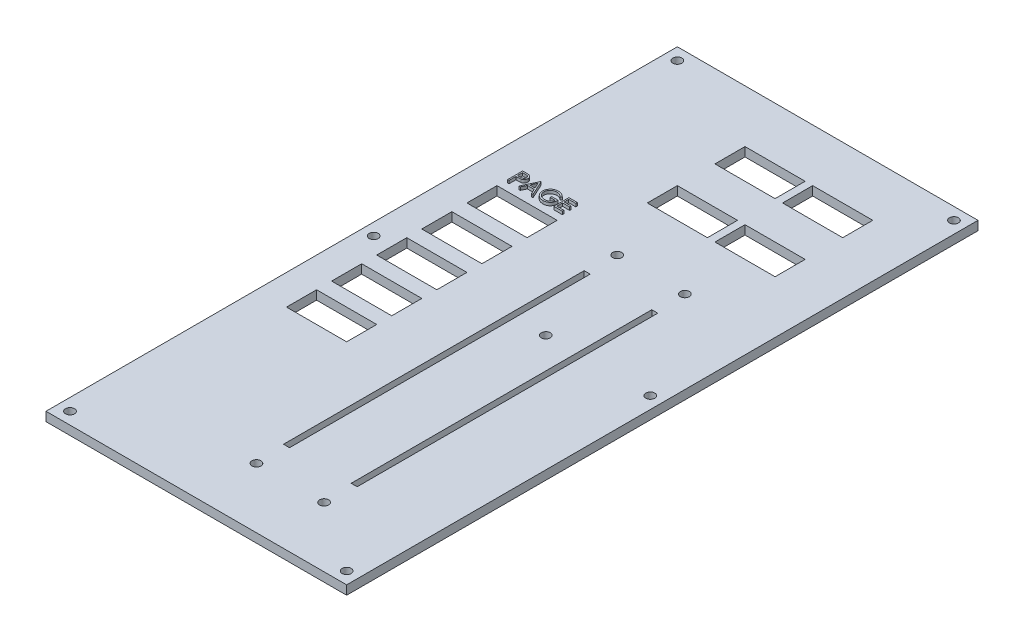
from build123d import *

# Parameters (mm, degrees)
SKETCH1_W            = 100
SKETCH1_H            = 210
BOSS_EXTRUDE1_DEPTH  = 3
CUT_EXTRUDE1_REACH   = 118.336
SKETCH3_R            = 1.5
SKETCH3_W            = 2
SKETCH3_H            = 100
LPATTERN1_COUNT      = 2
LPATTERN1_PITCH      = 22.5
CUT_EXTRUDE2_REACH   = 118.336
SKETCH4_W            = 20
SKETCH4_H            = 10
LPATTERN2_COUNT      = 2
LPATTERN2_PITCH      = 22.5
LPATTERN2_COUNT_DIR2 = 2
LPATTERN2_PITCH_DIR2 = 22.5
CUT_EXTRUDE3_REACH   = 118.336
SKETCH5_R            = 1.5
CUT_EXTRUDE4_REACH   = 118.336
SKETCH6_W            = 20
SKETCH6_H            = 10
LPATTERN3_COUNT      = 5
LPATTERN3_PITCH      = 15
CUT_EXTRUDE5_REACH   = 118.336
SKETCH7_R            = 1.5
CUT_EXTRUDE6_REACH   = 118.336
SKETCH8_R            = 1.5
BOSS_EXTRUDE2_DEPTH  = 1


with BuildPart() as part:
    # Sketch1 → Boss-Extrude1 (new body)
    with BuildSketch(Plane(origin=(0, 0, 0), x_dir=(1, 0, 0), z_dir=(0, 1, 0))):
        Rectangle(SKETCH1_W, SKETCH1_H)
    extrude(amount=BOSS_EXTRUDE1_DEPTH)

    # Sketch3 → Cut-Extrude1 (cut, up to next)
    with BuildSketch(Plane(origin=(0, 3, 0), x_dir=(1, 0, 0), z_dir=(0, 1, 0)), mode=Mode.PRIVATE) as cut_extrude1_sk1:
        with Locations(Location((0, -85, 0), (0, 0, 270))):
            Circle(SKETCH3_R)
    cut_extrude1_tool1 = extrude(cut_extrude1_sk1.sketch, amount=-CUT_EXTRUDE1_REACH, mode=Mode.PRIVATE) & part.part
    # Sketch3 → Cut-Extrude1 (cut, up to next)
    with BuildSketch(Plane(origin=(0, 3, 0), x_dir=(1, 0, 0), z_dir=(0, 1, 0)), mode=Mode.PRIVATE) as cut_extrude1_sk2:
        with Locations(Location((0, 35, 0), (0, 0, 270))):
            Circle(SKETCH3_R)
    cut_extrude1_tool2 = extrude(cut_extrude1_sk2.sketch, amount=-CUT_EXTRUDE1_REACH, mode=Mode.PRIVATE) & part.part
    # Sketch3 → Cut-Extrude1 (cut, up to next)
    with BuildSketch(Plane(origin=(0, 3, 0), x_dir=(1, 0, 0), z_dir=(0, 1, 0)), mode=Mode.PRIVATE) as cut_extrude1_sk3:
        with Locations((0, -25)):
            Rectangle(SKETCH3_W, SKETCH3_H)
    cut_extrude1_tool3 = extrude(cut_extrude1_sk3.sketch, amount=-CUT_EXTRUDE1_REACH, mode=Mode.PRIVATE) & part.part
    cut_extrude1_1 = cut_extrude1_tool1.solids().sort_by_distance((0, 3, 85))[0]
    add(cut_extrude1_1, mode=Mode.SUBTRACT)
    cut_extrude1_2 = cut_extrude1_tool2.solids().sort_by_distance((0, 3, -35))[0]
    add(cut_extrude1_2, mode=Mode.SUBTRACT)
    cut_extrude1_3 = cut_extrude1_tool3.solids().sort_by_distance((0, 3, 25))[0]
    add(cut_extrude1_3, mode=Mode.SUBTRACT)
    cut_extrude1 = cut_extrude1_1 + cut_extrude1_2 + cut_extrude1_3  # Cut-Extrude1 as one shape, for the pattern or mirror that repeats it

    # LPattern1: Cut-Extrude1 ×2
    with Locations(*[(i * LPATTERN1_PITCH, 0, 0) for i in range(1, LPATTERN1_COUNT)]):
        add(cut_extrude1, mode=Mode.SUBTRACT)

    # Sketch4 → Cut-Extrude2 (cut, up to next)
    with BuildSketch(Plane(origin=(0, 3, 0), x_dir=(1, 0, 0), z_dir=(0, 1, 0)), mode=Mode.PRIVATE) as cut_extrude2_sk1:
        with Locations((0, 60)):
            Rectangle(SKETCH4_W, SKETCH4_H)
    cut_extrude2_tool1 = extrude(cut_extrude2_sk1.sketch, amount=-CUT_EXTRUDE2_REACH, mode=Mode.PRIVATE) & part.part
    cut_extrude2 = cut_extrude2_tool1.solids().sort_by_distance((0, 3, -60))[0]
    add(cut_extrude2, mode=Mode.SUBTRACT)

    # LPattern2: Cut-Extrude2 2 × 2
    with Locations(*[(i * LPATTERN2_PITCH, 0, -j * LPATTERN2_PITCH_DIR2) for i in range(LPATTERN2_COUNT) for j in range(LPATTERN2_COUNT_DIR2) if (i, j) != (0, 0)]):
        add(cut_extrude2, mode=Mode.SUBTRACT)

    # Sketch5 → Cut-Extrude3 (cut, up to next)
    with BuildSketch(Plane(origin=(0, 3, 0), x_dir=(1, 0, 0), z_dir=(0, 1, 0)), mode=Mode.PRIVATE) as cut_extrude3_sk1:
        with Locations(Location((-46, 101, 0), (0, 0, 270))):
            Circle(SKETCH5_R)
    cut_extrude3_tool1 = extrude(cut_extrude3_sk1.sketch, amount=-CUT_EXTRUDE3_REACH, mode=Mode.PRIVATE) & part.part
    # Sketch5 → Cut-Extrude3 (cut, up to next)
    with BuildSketch(Plane(origin=(0, 3, 0), x_dir=(1, 0, 0), z_dir=(0, 1, 0)), mode=Mode.PRIVATE) as cut_extrude3_sk2:
        with Locations(Location((46, 101, 0), (0, 0, 270))):
            Circle(SKETCH5_R)
    cut_extrude3_tool2 = extrude(cut_extrude3_sk2.sketch, amount=-CUT_EXTRUDE3_REACH, mode=Mode.PRIVATE) & part.part
    # Sketch5 → Cut-Extrude3 (cut, up to next)
    with BuildSketch(Plane(origin=(0, 3, 0), x_dir=(1, 0, 0), z_dir=(0, 1, 0)), mode=Mode.PRIVATE) as cut_extrude3_sk3:
        with Locations(Location((46, -101, 0), (0, 0, 270))):
            Circle(SKETCH5_R)
    cut_extrude3_tool3 = extrude(cut_extrude3_sk3.sketch, amount=-CUT_EXTRUDE3_REACH, mode=Mode.PRIVATE) & part.part
    # Sketch5 → Cut-Extrude3 (cut, up to next)
    with BuildSketch(Plane(origin=(0, 3, 0), x_dir=(1, 0, 0), z_dir=(0, 1, 0)), mode=Mode.PRIVATE) as cut_extrude3_sk4:
        with Locations(Location((-46, -101, 0), (0, 0, 270))):
            Circle(SKETCH5_R)
    cut_extrude3_tool4 = extrude(cut_extrude3_sk4.sketch, amount=-CUT_EXTRUDE3_REACH, mode=Mode.PRIVATE) & part.part
    # Sketch5 → Cut-Extrude3 (cut, up to next)
    with BuildSketch(Plane(origin=(0, 3, 0), x_dir=(1, 0, 0), z_dir=(0, 1, 0)), mode=Mode.PRIVATE) as cut_extrude3_sk5:
        with Locations(Location((11.25, 0, 0), (0, 0, 270))):
            Circle(SKETCH5_R)
    cut_extrude3_tool5 = extrude(cut_extrude3_sk5.sketch, amount=-CUT_EXTRUDE3_REACH, mode=Mode.PRIVATE) & part.part
    add(cut_extrude3_tool1.solids().sort_by_distance((-46, 3, -101))[0], mode=Mode.SUBTRACT)
    add(cut_extrude3_tool2.solids().sort_by_distance((46, 3, -101))[0], mode=Mode.SUBTRACT)
    add(cut_extrude3_tool3.solids().sort_by_distance((46, 3, 101))[0], mode=Mode.SUBTRACT)
    add(cut_extrude3_tool4.solids().sort_by_distance((-46, 3, 101))[0], mode=Mode.SUBTRACT)
    add(cut_extrude3_tool5.solids().sort_by_distance((11.25, 3, 0))[0], mode=Mode.SUBTRACT)

    # Sketch6 → Cut-Extrude4 (cut, up to next)
    with BuildSketch(Plane(origin=(0, 3, 0), x_dir=(1, 0, 0), z_dir=(0, 1, 0)), mode=Mode.PRIVATE) as cut_extrude4_sk1:
        with Locations((-30, 30)):
            Rectangle(SKETCH6_W, SKETCH6_H)
    cut_extrude4_tool1 = extrude(cut_extrude4_sk1.sketch, amount=-CUT_EXTRUDE4_REACH, mode=Mode.PRIVATE) & part.part
    cut_extrude4 = cut_extrude4_tool1.solids().sort_by_distance((-30, 3, -30))[0]
    add(cut_extrude4, mode=Mode.SUBTRACT)

    # LPattern3: Cut-Extrude4 ×5
    with Locations(*[(0, 0, i * LPATTERN3_PITCH) for i in range(1, LPATTERN3_COUNT)]):
        add(cut_extrude4, mode=Mode.SUBTRACT)

    # Sketch7 → Cut-Extrude5 (cut, up to next)
    with BuildSketch(Plane(origin=(0, 3, 0), x_dir=(1, 0, 0), z_dir=(0, 1, 0)), mode=Mode.PRIVATE) as cut_extrude5_sk1:
        with Locations(Location((-46, 0, 0), (0, 0, 270))):
            Circle(SKETCH7_R)
    cut_extrude5_tool1 = extrude(cut_extrude5_sk1.sketch, amount=-CUT_EXTRUDE5_REACH, mode=Mode.PRIVATE) & part.part
    add(cut_extrude5_tool1.solids().sort_by_distance((-46, 3, 0))[0], mode=Mode.SUBTRACT)

    # Sketch8 → Cut-Extrude6 (cut, up to next)
    with BuildSketch(Plane(origin=(0, 3, 0), x_dir=(1, 0, 0), z_dir=(0, 1, 0)), mode=Mode.PRIVATE) as cut_extrude6_sk1:
        with Locations(Location((46, 0, 0), (0, 0, 270))):
            Circle(SKETCH8_R)
    cut_extrude6_tool1 = extrude(cut_extrude6_sk1.sketch, amount=-CUT_EXTRUDE6_REACH, mode=Mode.PRIVATE) & part.part
    add(cut_extrude6_tool1.solids().sort_by_distance((46, 3, 0))[0], mode=Mode.SUBTRACT)

    # Sketch10 → Boss-Extrude2 (add)
    # profile 1 of 4: a face of its own
    with BuildSketch(Plane(origin=(0, 3, 0), x_dir=(1, 0, 0), z_dir=(0, 1, 0))):
        with BuildLine():
            Line((-38.958974359, 42.5), (-37.978405449, 42.5))
            add(Edge.make_bspline(
                [(-37.978405449, 42.5), (-37.910961297, 42.499925863), (-37.781735307, 42.499783812), (-37.596428085, 42.495477032), (-37.428128468, 42.489724615), (-37.277199353, 42.481750482), (-37.143176355, 42.472326781), (-37.026665927, 42.459109582), (-36.926752276, 42.44530916), (-36.866885919, 42.431278579), (-36.839583333, 42.424879808)],
                knots=[0, 0, 0, 0, 1.415646017, 2.712440637, 3.8905458, 4.950247383, 5.884950622, 6.709939814, 7.411656543, 8, 8, 8, 8], degree=3))
            add(Edge.make_bspline(
                [(-36.839583333, 42.424879808), (-36.805021142, 42.415419879), (-36.736711175, 42.396722934), (-36.638281113, 42.359274758), (-36.544632763, 42.314871665), (-36.455444822, 42.264266036), (-36.371813275, 42.205286659), (-36.292490359, 42.140324348), (-36.218176101, 42.06787925), (-36.149288399, 41.988763907), (-36.086024402, 41.904306464), (-36.031553427, 41.813246136), (-35.985943102, 41.717115703), (-35.946824143, 41.615982029), (-35.918669208, 41.508995853), (-35.897459352, 41.39690055), (-35.883997026, 41.279708135), (-35.882707652, 41.19962261), (-35.882051282, 41.158854167)],
                knots=[0, 0, 0, 0, 0.999701418, 1.975846123, 2.934577507, 3.890451536, 4.834027766, 5.787354733, 6.749476667, 7.726910423, 8.712836071, 9.690891519, 10.682875813, 11.679750201, 12.712814741, 13.765529915, 14.8625177, 16, 16, 16, 16], degree=3))
            add(Edge.make_bspline(
                [(-35.882051282, 41.158854167), (-35.882653317, 41.117743057), (-35.88383124, 41.037306394), (-35.897968791, 40.919630982), (-35.917011922, 40.807176139), (-35.946293425, 40.70019121), (-35.984644386, 40.599311538), (-36.029633033, 40.502995492), (-36.08389522, 40.412881675), (-36.146244976, 40.328642936), (-36.215604397, 40.250200204), (-36.291680023, 40.178121926), (-36.374164726, 40.112830014), (-36.462796366, 40.054178095), (-36.558439008, 40.003526267), (-36.659642084, 39.958158688), (-36.767285251, 39.920057173), (-36.841774556, 39.900014228), (-36.879647436, 39.889823718)],
                knots=[0, 0, 0, 0, 1.121902311, 2.195077645, 3.232258892, 4.234102512, 5.217864754, 6.176164875, 7.132989551, 8.084763148, 9.034132444, 9.988522005, 10.94243251, 11.903244335, 12.886203696, 13.894208494, 14.929344452, 16, 16, 16, 16], degree=3))
            add(Edge.make_bspline(
                [(-36.879647436, 39.889823718), (-36.910972199, 39.883162316), (-36.979622238, 39.868563468), (-37.09268327, 39.852265672), (-37.224319535, 39.838354814), (-37.374351364, 39.827924617), (-37.542644085, 39.81899552), (-37.729288738, 39.811898243), (-37.934651706, 39.807998451), (-38.07789634, 39.807797319), (-38.152684295, 39.807692308)],
                knots=[0, 0, 0, 0, 0.601384939, 1.31797006, 2.144135048, 3.087295005, 4.142315834, 5.309527816, 6.595305764, 8, 8, 8, 8], degree=3))
            Line((-38.152684295, 39.807692308), (-38.51025641, 39.807692308))
            Line((-38.51025641, 39.807692308), (-38.51025641, 37.5))
            Line((-38.51025641, 37.5), (-38.958974359, 37.5))
            Line((-38.958974359, 37.5), (-38.958974359, 42.5))
        make_face()
        with BuildLine():
            Line((-38.51025641, 41.987179487), (-38.51025641, 40.320512821))
            Line((-38.51025641, 40.320512821), (-37.634855769, 40.309495192))
            add(Edge.make_bspline(
                [(-37.634855769, 40.309495192), (-37.592113018, 40.309473101), (-37.509599018, 40.309430456), (-37.390404414, 40.315123632), (-37.279819717, 40.321695821), (-37.17818461, 40.331318569), (-37.085453275, 40.344920366), (-37.001471091, 40.35865142), (-36.926889258, 40.378516224), (-36.839604684, 40.405263465), (-36.742342759, 40.450881488), (-36.636531975, 40.517095616), (-36.546859709, 40.601496628), (-36.469262142, 40.69639353), (-36.407682317, 40.801963715), (-36.362602328, 40.914919339), (-36.33611496, 41.034101981), (-36.332563255, 41.115656465), (-36.330769231, 41.156850962)],
                knots=[0, 0, 0, 0, 1.160613943, 2.240541288, 3.23993089, 4.169200891, 5.011653406, 5.7853311, 6.478053781, 7.106038997, 8.262395093, 9.384106736, 10.481365981, 11.59014053, 12.70357646, 13.786202915, 14.881775077, 16, 16, 16, 16], degree=3))
            add(Edge.make_bspline(
                [(-36.330769231, 41.156850962), (-36.332573011, 41.197048838), (-36.336158704, 41.276957241), (-36.362809937, 41.394069756), (-36.407594671, 41.505835048), (-36.469675521, 41.610082313), (-36.545019992, 41.704637747), (-36.632590482, 41.7867765), (-36.732180856, 41.852807504), (-36.824821186, 41.895426478), (-36.907108594, 41.9214483), (-36.978582823, 41.939655215), (-37.059283786, 41.954191795), (-37.149237757, 41.965962513), (-37.24774752, 41.976038887), (-37.355659398, 41.982875997), (-37.472564603, 41.986878077), (-37.553722561, 41.987076585), (-37.595793269, 41.987179487)],
                knots=[0, 0, 0, 0, 1.120700087, 2.227813068, 3.331159281, 4.466773991, 5.599788987, 6.693661531, 7.80175334, 8.91857717, 9.525282508, 10.207424825, 10.974604443, 11.810962634, 12.737642355, 13.736264703, 14.826523623, 16, 16, 16, 16], degree=3))
            Line((-37.595793269, 41.987179487), (-38.51025641, 41.987179487))
        make_face(mode=Mode.SUBTRACT)
    # profile 2 of 4: a face of its own
    with BuildSketch(Plane(origin=(0, 3, 0), x_dir=(1, 0, 0), z_dir=(0, 1, 0))):
        Polygon((-32.805128205, 42.5), (-30.497435897, 37.5), (-30.985216346, 37.5), (-31.724399038, 39.102564103), (-33.991025641, 39.102564103), (-34.751241987, 37.5), (-35.241025641, 37.5), (-32.869230769, 42.5), align=None)
        Polygon((-32.8421875, 41.525440705), (-33.747636218, 39.615384615), (-31.960777244, 39.615384615), align=None, mode=Mode.SUBTRACT)
    # profile 3 of 4: a face of its own
    with BuildSketch(Plane(origin=(0, 3, 0), x_dir=(1, 0, 0), z_dir=(0, 1, 0))):
        with BuildLine():
            Line((-24.920512821, 41.646634615), (-25.305128205, 41.282051282))
            add(Edge.make_bspline(
                [(-25.305128205, 41.282051282), (-25.374726617, 41.347523943), (-25.512263826, 41.476908033), (-25.736492744, 41.644780884), (-25.970440793, 41.788589598), (-26.212887217, 41.905598507), (-26.457828008, 41.998959594), (-26.702011974, 42.065428365), (-26.942934405, 42.107817705), (-27.103173288, 42.112886804), (-27.18213141, 42.115384615)],
                knots=[0, 0, 0, 0, 1.08915593, 2.152340314, 3.188132944, 4.216796309, 5.218260357, 6.173443236, 7.099959455, 8, 8, 8, 8], degree=3))
            add(Edge.make_bspline(
                [(-27.18213141, 42.115384615), (-27.230580982, 42.11479375), (-27.327354468, 42.113613551), (-27.471100103, 42.098550386), (-27.613338155, 42.076886295), (-27.753800119, 42.045540755), (-27.8927591, 42.005813528), (-28.029731803, 41.956120009), (-28.164973738, 41.898183945), (-28.297210997, 41.831237554), (-28.425411716, 41.757694917), (-28.54649291, 41.676197001), (-28.661226337, 41.589355873), (-28.767455516, 41.494997331), (-28.865791497, 41.393976095), (-28.958574886, 41.288171372), (-29.042542451, 41.174692488), (-29.118386972, 41.055627308), (-29.186046427, 40.933067038), (-29.245773075, 40.808191338), (-29.295911773, 40.681414403), (-29.335582423, 40.55257715), (-29.368311929, 40.422676307), (-29.391337082, 40.29081242), (-29.404318113, 40.156844298), (-29.406563513, 40.067133929), (-29.407692308, 40.022035256)],
                knots=[0, 0, 0, 0, 1.02818874, 2.053710826, 3.065248034, 4.081641283, 5.106893873, 6.131558223, 7.173050175, 8.228653731, 9.27666206, 10.308777013, 11.325269123, 12.329503258, 13.32196095, 14.316845687, 15.314881793, 16.315733098, 17.311955233, 18.285320748, 19.252783886, 20.203351036, 21.145449891, 22.095197417, 23.042428769, 24, 24, 24, 24], degree=3))
            add(Edge.make_bspline(
                [(-29.407692308, 40.022035256), (-29.40661271, 39.975934089), (-29.404456463, 39.883857641), (-29.390656007, 39.746437537), (-29.365044235, 39.611058391), (-29.33080465, 39.477275344), (-29.287974914, 39.344859275), (-29.234585391, 39.214384261), (-29.171348819, 39.085855131), (-29.098153744, 38.960429964), (-29.017887739, 38.838254216), (-28.927969052, 38.723169185), (-28.832453933, 38.61364236), (-28.727862648, 38.512105555), (-28.617549016, 38.415842846), (-28.498217193, 38.327506386), (-28.372213678, 38.245394639), (-28.239346232, 38.170542468), (-28.101056543, 38.103673131), (-27.959261182, 38.044210423), (-27.813507159, 37.995239941), (-27.66456046, 37.955328364), (-27.512598643, 37.922613653), (-27.356850354, 37.901567253), (-27.19846077, 37.886294637), (-27.091691296, 37.885177966), (-27.037900641, 37.884615385)],
                knots=[0, 0, 0, 0, 0.93586088, 1.869166235, 2.799637598, 3.729985548, 4.670839027, 5.622275134, 6.589130586, 7.576015415, 8.568469353, 9.55398029, 10.53834874, 11.515998671, 12.510579167, 13.508179873, 14.527009472, 15.561807829, 16.601455013, 17.643573243, 18.680854198, 19.719860599, 20.772568776, 21.833555941, 22.908541556, 24, 24, 24, 24], degree=3))
            add(Edge.make_bspline(
                [(-27.037900641, 37.884615385), (-26.973074431, 37.885970494), (-26.845777635, 37.88863147), (-26.658654145, 37.909346169), (-26.478935473, 37.941698732), (-26.307126611, 37.989078584), (-26.14302801, 38.049512406), (-25.986038094, 38.122362958), (-25.837392867, 38.210424471), (-25.696645476, 38.309815709), (-25.566992354, 38.420551184), (-25.450057891, 38.540043263), (-25.347707192, 38.66771193), (-25.258414765, 38.802805237), (-25.184545258, 38.946441387), (-25.123912694, 39.097916477), (-25.077436563, 39.257298637), (-25.058358028, 39.367429539), (-25.048717949, 39.423076923)],
                knots=[0, 0, 0, 0, 1.13008108, 2.219097802, 3.278683437, 4.311054135, 5.322181354, 6.324827112, 7.324222904, 8.330512327, 9.32562643, 10.293043162, 11.24128371, 12.174520618, 13.111833804, 14.052305215, 15.015860969, 16, 16, 16, 16], degree=3))
            Line((-25.048717949, 39.423076923), (-26.715384615, 39.423076923))
            Line((-26.715384615, 39.423076923), (-26.715384615, 39.935897436))
            Line((-26.715384615, 39.935897436), (-24.6, 39.935897436))
            add(Edge.make_bspline(
                [(-24.6, 39.935897436), (-24.602436926, 39.840315309), (-24.607206431, 39.653243821), (-24.640662025, 39.380429148), (-24.694685614, 39.122755301), (-24.768486059, 38.879950912), (-24.864022174, 38.652360066), (-24.980268643, 38.439751685), (-25.119085959, 38.243499284), (-25.275529447, 38.062000708), (-25.451100815, 37.900101833), (-25.641055987, 37.757807636), (-25.845708799, 37.637946757), (-26.064865666, 37.540431525), (-26.297809143, 37.464325818), (-26.545078257, 37.410366423), (-26.806337686, 37.378037904), (-26.985390082, 37.373907362), (-27.076963141, 37.371794872)],
                knots=[0, 0, 0, 0, 1.140356446, 2.231883559, 3.274166699, 4.278491846, 5.25512956, 6.21435461, 7.1637429, 8.11826594, 9.068280886, 10.0076534, 10.945064095, 11.891975133, 12.864533718, 13.863980011, 14.907571808, 16, 16, 16, 16], degree=3))
            add(Edge.make_bspline(
                [(-27.076963141, 37.371794872), (-27.133406192, 37.372607902), (-27.244730078, 37.37421146), (-27.40914569, 37.385607671), (-27.569028005, 37.403151351), (-27.724353732, 37.429644385), (-27.875694221, 37.46209389), (-28.022293628, 37.503646346), (-28.164710402, 37.551744488), (-28.303164668, 37.606452593), (-28.436399734, 37.669840674), (-28.565009044, 37.740283016), (-28.68970351, 37.817416388), (-28.809633745, 37.902574739), (-28.925424633, 37.995121111), (-29.036329553, 38.095240995), (-29.142969378, 38.202628309), (-29.209770041, 38.278884037), (-29.243429487, 38.317307692)],
                knots=[0, 0, 0, 0, 1.107784379, 2.184907829, 3.233506516, 4.263428166, 5.276301166, 6.270063455, 7.25232949, 8.225834625, 9.190232166, 10.146266622, 11.1027726, 12.066435141, 13.031522626, 14.010570082, 14.99756817, 16, 16, 16, 16], degree=3))
            add(Edge.make_bspline(
                [(-29.243429487, 38.317307692), (-29.292266533, 38.378265768), (-29.389129979, 38.499170078), (-29.51381306, 38.692884285), (-29.620100779, 38.893458371), (-29.706340525, 39.101450697), (-29.773680648, 39.316666715), (-29.821975295, 39.538831417), (-29.850271422, 39.768230889), (-29.854347904, 39.923466981), (-29.856410256, 40.002003205)],
                knots=[0, 0, 0, 0, 1.023165419, 2.029347347, 3.013907458, 3.994755782, 4.975994455, 5.96558838, 6.970761222, 8, 8, 8, 8], degree=3))
            add(Edge.make_bspline(
                [(-29.856410256, 40.002003205), (-29.855649916, 40.060812138), (-29.854138899, 40.177682577), (-29.835816733, 40.351193016), (-29.809528993, 40.521622576), (-29.770890344, 40.688831942), (-29.722181394, 40.852932788), (-29.6613907, 41.014001308), (-29.590612277, 41.172132553), (-29.508347283, 41.326238078), (-29.416798055, 41.474272954), (-29.317440597, 41.615641244), (-29.208864026, 41.74776848), (-29.092841455, 41.872327978), (-28.967988612, 41.987754902), (-28.835475149, 42.095117917), (-28.695198945, 42.19456104), (-28.546718688, 42.284517946), (-28.392250567, 42.365323118), (-28.232164851, 42.43616485), (-28.066510407, 42.494712443), (-27.896528296, 42.544389271), (-27.720931866, 42.581125186), (-27.540995385, 42.607766251), (-27.355780939, 42.625995679), (-27.230586612, 42.627461759), (-27.167107372, 42.628205128)],
                knots=[0, 0, 0, 0, 1.008945113, 2.00506715, 2.99143336, 3.967273523, 4.948097931, 5.927297278, 6.919902385, 7.919676788, 8.923139349, 9.905703106, 10.883022732, 11.856032218, 12.825136022, 13.798837087, 14.781400844, 15.773989409, 16.776158564, 17.77167057, 18.775803737, 19.789618931, 20.80898985, 21.851988756, 22.910860228, 24, 24, 24, 24], degree=3))
            add(Edge.make_bspline(
                [(-27.167107372, 42.628205128), (-27.115338452, 42.627377283), (-27.012686768, 42.625735763), (-26.859935722, 42.614357694), (-26.709545701, 42.596323578), (-26.561293716, 42.571713883), (-26.415684621, 42.538194325), (-26.272303613, 42.49808249), (-26.130942847, 42.451379886), (-25.992045349, 42.395681534), (-25.854677183, 42.33246207), (-25.718074554, 42.261300038), (-25.582704202, 42.180978603), (-25.448331372, 42.091259267), (-25.314108717, 41.993682955), (-25.182159228, 41.885458922), (-25.049297879, 41.770854985), (-24.963866716, 41.688451865), (-24.920512821, 41.646634615)],
                knots=[0, 0, 0, 0, 0.985871117, 1.954866573, 2.915460327, 3.869826059, 4.81536089, 5.759505086, 6.70452669, 7.649098992, 8.607881297, 9.583363685, 10.581137262, 11.603961102, 12.659522466, 13.73993555, 14.853081303, 16, 16, 16, 16], degree=3))
        make_face()
    # profile 4 of 4: a face of its own
    with BuildSketch(Plane(origin=(0, 3, 0), x_dir=(1, 0, 0), z_dir=(0, 1, 0))):
        Polygon((-23.574358974, 42.5), (-20.753846154, 42.5), (-20.753846154, 41.987179487), (-23.125641026, 41.987179487), (-23.125641026, 40.448717949), (-20.753846154, 40.448717949), (-20.753846154, 39.935897436), (-23.125641026, 39.935897436), (-23.125641026, 38.012820513), (-20.753846154, 38.012820513), (-20.753846154, 37.5), (-23.574358974, 37.5), align=None)
    extrude(amount=BOSS_EXTRUDE2_DEPTH)


solid = part.part
